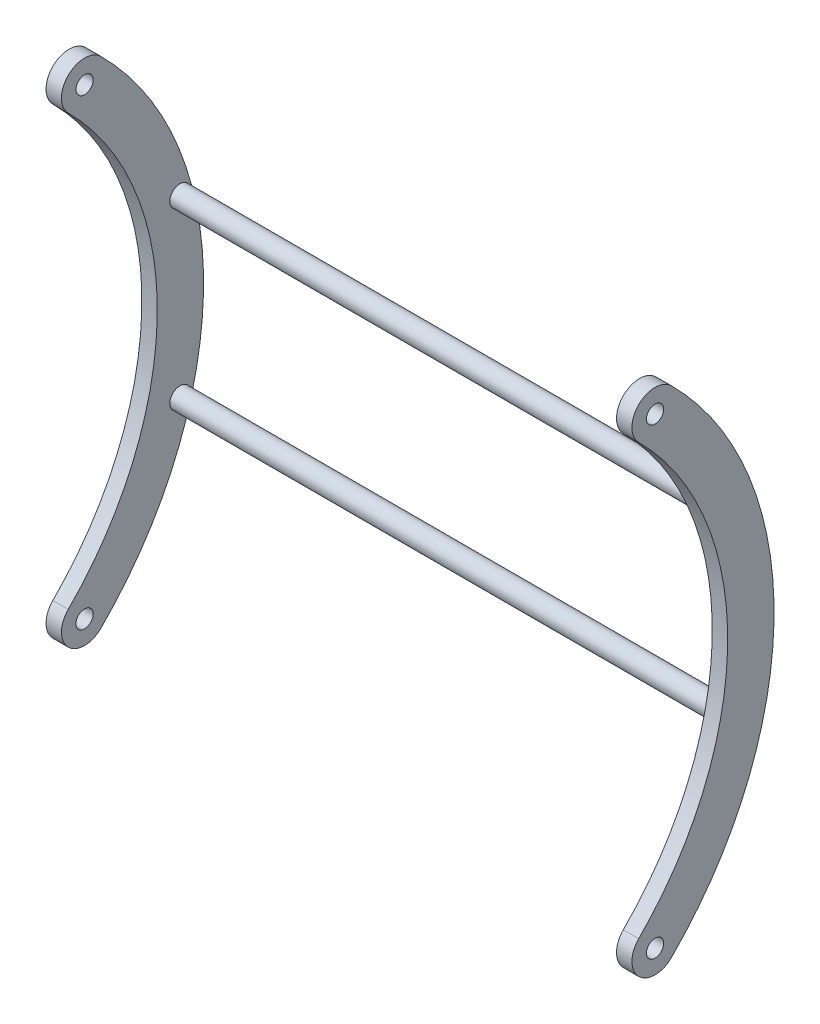
from build123d import *

# Parameters (mm, degrees)
BOSS_EXTRUDE1_DEPTH  = 3
SKETCH4_R            = 1.68
CUT_EXTRUDE1_DEPTH   = 54.466990195
SKETCH2_R            = 2
BOSS_EXTRUDE11_DEPTH = 108
SKETCH8_R            = 1.68
BOSS_EXTRUDE12_DEPTH = 3


with BuildPart() as part:
    # Sketch1 → Boss-Extrude1 (new body)
    with BuildSketch(Plane(origin=(0, 0, 0), x_dir=(0, 0, -1), z_dir=(1, 0, 0))):
        with BuildLine():
            ThreePointArc((-15.634588923, -40.698575462), (-15.635835692, -47.061289367), (-9.273122764, -47.06502941))
            ThreePointArc((-9.273122764, -47.06502941), (10.707664933, 1.119443717), (-9.273121767, 49.303917257))
            ThreePointArc((-9.273121767, 49.303917257), (-15.635834695, 49.300177346), (-15.634588058, 42.937463441))
            ThreePointArc((-15.634588058, 42.937463441), (1.687002572, 1.11944381), (-15.634588923, -40.698575462))
        make_face()
    extrude(amount=BOSS_EXTRUDE1_DEPTH)

    # Sketch4 → Cut-Extrude1 (cut, through all)
    with BuildSketch(Plane(origin=(3, 0, 0), x_dir=(0, 0, -1), z_dir=(1, 0, 0))):
        with Locations((-12.453854912, 46.120690349)):
            Circle(SKETCH4_R)
        with Locations((-12.453855844, -43.881802436)):
            Circle(SKETCH4_R)
    extrude(amount=-CUT_EXTRUDE1_DEPTH, mode=Mode.SUBTRACT)

    # Sketch2 → Boss-Extrude11 (add)
    with BuildSketch(Plane.ZY):
        with Locations(Location((-6.118587434, 18.157847035, 0), (0, 0, 180))):
            Circle(SKETCH2_R)
        with Locations(Location((-6.118587434, -15.875057848, 0), (0, 0, 180))):
            Circle(SKETCH2_R)
    extrude(amount=BOSS_EXTRUDE11_DEPTH)

    # Sketch8 → Boss-Extrude12 (add)
    with BuildSketch(Plane.ZY.offset(108)):
        with BuildLine():
            ThreePointArc((9.273121767, 49.303917257), (15.63708182, 49.301423495), (15.634588058, 42.937463441))
            ThreePointArc((15.634588058, 42.937463441), (-1.696602448, 1.11944381), (15.634588923, -40.698575462))
            ThreePointArc((15.634588923, -40.698575462), (15.637082818, -47.062535516), (9.273122764, -47.06502941))
            ThreePointArc((9.273122764, -47.06502941), (-10.696601757, 1.119443717), (9.273121767, 49.303917257))
        make_face()
        with Locations(Location((12.453854912, 46.120690349, 0), (0, 0, 180))):
            Circle(SKETCH8_R, mode=Mode.SUBTRACT)
        with Locations(Location((12.453855844, -43.881802436, 0), (0, 0, 180))):
            Circle(SKETCH8_R, mode=Mode.SUBTRACT)
    extrude(amount=BOSS_EXTRUDE12_DEPTH)


solid = part.part
